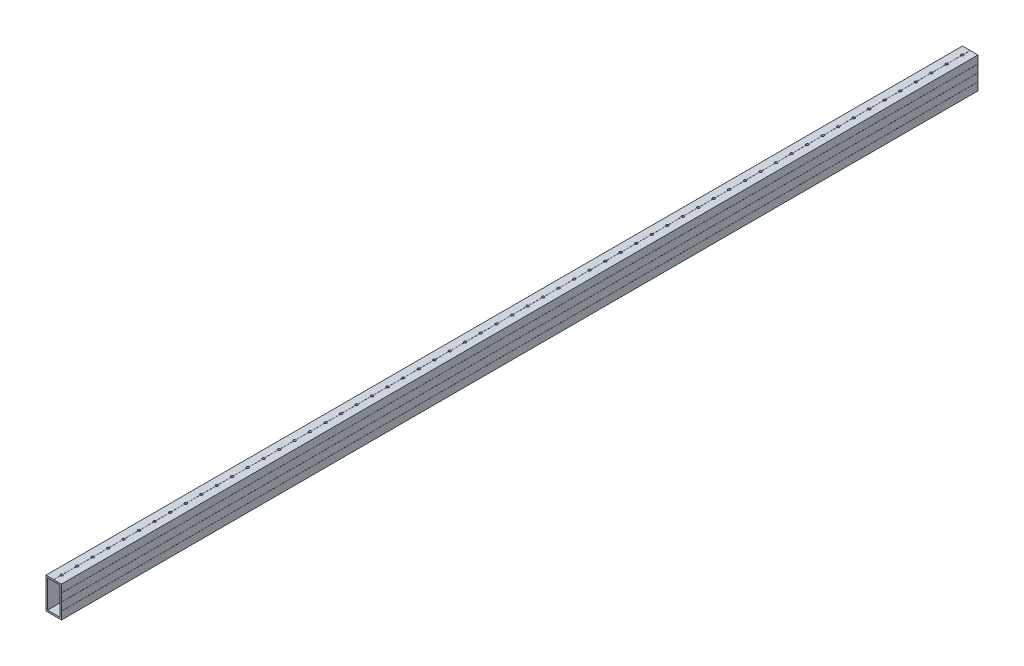
from build123d import *

# Parameters (mm, degrees)
SKETCH1_W             = 25.4
SKETCH1_H             = 50.8
SKETCH1_W_2           = 20.32
SKETCH1_H_2           = 45.72
BOSS_EXTRUDE1_DEPTH   = 1498.6
F_8_CLEARANCE_HOLE1_D = 4.1402
CUT_EXTRUDE1_DEPTH    = 1499.869043646


with BuildPart() as part:
    # Sketch1 → Boss-Extrude1 (new body)
    with BuildSketch(Plane.XY):
        Rectangle(SKETCH1_W, SKETCH1_H)
        Rectangle(SKETCH1_W_2, SKETCH1_H_2, mode=Mode.SUBTRACT)
    extrude(amount=-BOSS_EXTRUDE1_DEPTH)

    # #8 Clearance Hole1 (through all)
    with Locations(Plane(origin=(0, 25.4, 0), x_dir=(1, 0, 0), z_dir=(0, 1, 0))):
        with Locations((0, 12.7), (0, 38.1), (0, 63.5), (0, 88.9), (0, 114.3), (0, 139.7), (0, 165.1), (0, 190.5), (0, 215.9), (0, 241.3), (0, 266.7), (0, 292.1), (0, 317.5), (0, 342.9), (0, 368.3), (0, 393.7), (0, 419.1), (0, 444.5), (0, 469.9), (0, 495.3), (0, 520.7), (0, 546.1), (0, 571.5), (0, 596.9), (0, 622.3), (0, 647.7), (0, 673.1), (0, 698.5), (0, 723.9), (0, 749.3), (0, 774.7), (0, 800.1), (0, 825.5), (0, 850.9), (0, 876.3), (0, 901.7), (0, 927.1), (0, 952.5), (0, 977.9), (0, 1003.3), (0, 1028.7), (0, 1054.1), (0, 1079.5), (0, 1104.9), (0, 1130.3), (0, 1155.7), (0, 1181.1), (0, 1206.5), (0, 1231.9), (0, 1257.3), (0, 1282.7), (0, 1308.1), (0, 1333.5), (0, 1358.9), (0, 1384.3), (0, 1409.7), (0, 1435.1), (0, 1460.5), (0, 1485.9)):
            Hole(F_8_CLEARANCE_HOLE1_D / 2)

    # Sketch2 → Cut-Extrude1 (cut, through all)
    with BuildSketch(Plane.XY):
        Polygon((-12.7, 12.6238), (-12.7, 12.7762), (-12.6238, 12.7), align=None)
        Polygon((12.7, 12.6238), (12.6238, 12.7), (12.7, 12.7762), align=None)
        Polygon((-12.6238, 0), (-12.7, 0.0762), (-12.7, -0.0762), align=None)
        Polygon((12.7, -0.0762), (12.6238, 0), (12.7, 0.0762), align=None)
        Polygon((-12.6238, -12.7), (-12.7, -12.6238), (-12.7, -12.7762), align=None)
        Polygon((12.7, -12.7762), (12.6238, -12.7), (12.7, -12.6238), align=None)
        Polygon((-0.0762, -25.4), (0.0762, -25.4), (0, -25.3238), align=None)
        Polygon((0.0762, 25.4), (0, 25.3238), (-0.0762, 25.4), align=None)
    extrude(amount=-CUT_EXTRUDE1_DEPTH, mode=Mode.SUBTRACT)


solid = part.part
